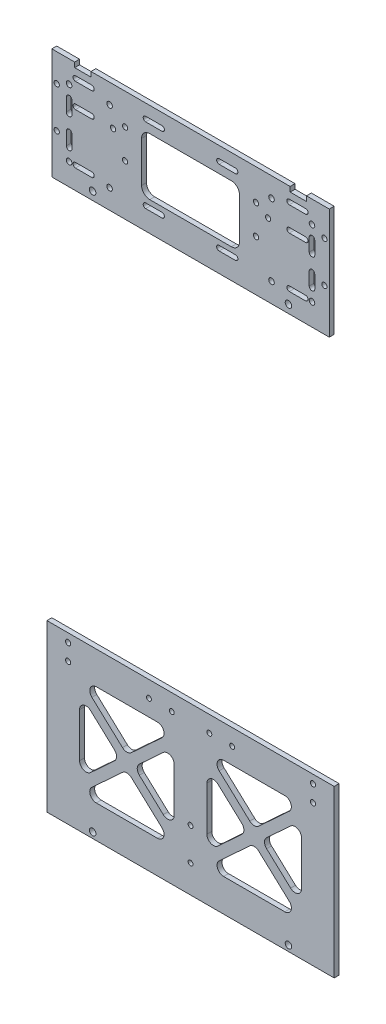
from build123d import *

# Parameters (mm, degrees)
SKETCH_1_W           = 176
SKETCH_1_H           = 403.5
SKETCH_1_R           = 2
EXTRUDE_1_DEPTH      = 3
SKETCH_3_R           = 1.6
SKETCH_3_R_2         = 1.5
SKETCH_3_W           = 60
SKETCH_3_H           = 35
CUT_EXTRUDE_2_DEPTH  = 247.278297866
SKETCH_5_R           = 1.5
CUT_EXTRUDE_3_DEPTH  = 247.278297866
SKETCH_7_W           = 58
SKETCH_7_H           = 61.65
CUT_EXTRUDE_4_DEPTH  = 247.278297866
SKETCH_11_R          = 1.6
SKETCH_11_W          = 176
SKETCH_11_H          = 236.85
CUT_EXTRUDE_7_DEPTH  = 10
SKETCH_12_W          = 10
SKETCH_12_H          = 3
CUT_EXTRUDE_8_DEPTH  = 247.278297866
SKETCH_13_R          = 1.5
CUT_EXTRUDE_9_DEPTH  = 247.278297866
FILLET_1_R           = 5
SKETCH_14_W          = 3
SKETCH_14_H          = 65
CUT_EXTRUDE_10_DEPTH = 247.278297866
SKETCH_15_R          = 1.5
SKETCH_15_W          = 3
SKETCH_15_H          = 10
CUT_EXTRUDE_11_DEPTH = 247.278297866
SKETCH_16_R          = 1.5
CUT_EXTRUDE_12_DEPTH = 247.278297866
EXTRUDE_2_DEPTH      = 3
FILLET_2_R           = 4
SKETCH_18_R          = 1.6
CUT_EXTRUDE_13_DEPTH = 247.278297866
SKETCH_19_W          = 14
SKETCH_19_H          = 3
SKETCH_19_W_2        = 122
EXTRUDE_3_DEPTH      = 3
SKETCH_20_R          = 1.7
CUT_EXTRUDE_14_DEPTH = 10
SKETCH_21_R          = 1.5
EXTRUDE_4_DEPTH      = 3
SKETCH_22_R          = 1.7
CUT_EXTRUDE_15_DEPTH = 3


with BuildPart() as part:
    # 草图1 → 凸台-拉伸1 (new body)
    with BuildSketch(Plane.XY):
        with Locations((0, 28.25)):
            Rectangle(SKETCH_1_W, SKETCH_1_H)
        with Locations((-60, 170)):
            Circle(SKETCH_1_R, mode=Mode.SUBTRACT)
        with Locations((60, 170)):
            Circle(SKETCH_1_R, mode=Mode.SUBTRACT)
        with Locations((-60, -170)):
            Circle(SKETCH_1_R, mode=Mode.SUBTRACT)
        with Locations((60, -170)):
            Circle(SKETCH_1_R, mode=Mode.SUBTRACT)
    extrude(amount=EXTRUDE_1_DEPTH)

    # 草图3 → 切除-拉伸2 (cut, through all)
    with BuildSketch(Plane(origin=(0, 0, 0), x_dir=(-1, 0, 0), z_dir=(0, 0, -1))):
        with Locations((-40.1, 214)):
            Circle(SKETCH_3_R)
        with Locations((-40.1, 196)):
            Circle(SKETCH_3_R)
        with Locations((40.1, 214)):
            Circle(SKETCH_3_R)
        with Locations((40.1, 196)):
            Circle(SKETCH_3_R)
        with Locations((0, -136.5)):
            Circle(SKETCH_3_R_2)
        with Locations((0, -156.5)):
            Circle(SKETCH_3_R_2)
        with Locations((0, 200.5)):
            Rectangle(SKETCH_3_W, SKETCH_3_H)
    extrude(amount=-CUT_EXTRUDE_2_DEPTH, mode=Mode.SUBTRACT)

    # 草图5 → 切除-拉伸3 (cut, through all)
    with BuildSketch(Plane(origin=(0, 0, 0), x_dir=(-1, 0, 0), z_dir=(0, 0, -1))):
        with Locations((11.5, -81.85)):
            Circle(SKETCH_5_R)
        with Locations((25.5, -81.85)):
            Circle(SKETCH_5_R)
        with Locations(Location((-25.5, -81.85, 0), (0, 0, 180))):
            Circle(SKETCH_5_R)
        with Locations(Location((-11.5, -81.85, 0), (0, 0, 180))):
            Circle(SKETCH_5_R)
    extrude(amount=-CUT_EXTRUDE_3_DEPTH, mode=Mode.SUBTRACT)

    # 草图7 → 切除-拉伸4 (cut, through all)
    with BuildSketch(Plane(origin=(0, 0, 0), x_dir=(-1, 0, 0), z_dir=(0, 0, -1))):
        with Locations((-39, -122.675)):
            Rectangle(SKETCH_7_W, SKETCH_7_H)
        with Locations((39, -122.675)):
            Rectangle(SKETCH_7_W, SKETCH_7_H)
    extrude(amount=-CUT_EXTRUDE_4_DEPTH, mode=Mode.SUBTRACT)

    # 草图11 → 切除-拉伸7 (cut)
    with BuildSketch(Plane(origin=(0, 0, 0), x_dir=(-1, 0, 0), z_dir=(0, 0, -1))):
        with Locations((-75, -77)):
            Circle(SKETCH_11_R)
        with Locations((-75, -87)):
            Circle(SKETCH_11_R)
        with Locations((75, -77)):
            Circle(SKETCH_11_R)
        with Locations((75, -87)):
            Circle(SKETCH_11_R)
        with Locations((-82, 216)):
            Circle(SKETCH_11_R)
        with Locations((-82, 191)):
            Circle(SKETCH_11_R)
        with Locations((82, 216)):
            Circle(SKETCH_11_R)
        with Locations((82, 191)):
            Circle(SKETCH_11_R)
        with Locations((0, 46.575)):
            Rectangle(SKETCH_11_W, SKETCH_11_H)
    extrude(amount=-CUT_EXTRUDE_7_DEPTH, mode=Mode.SUBTRACT)


with BuildPart() as cut_extrude_7_piece_1:
    # of the separate pieces the step leaves, piece 1, a body of its own (cut_extrude_7_pieces)
    add(part.part.solids().sort_by_distance((-88, -173.5, 0))[0])

    # 草图17 → 凸台-拉伸2 (add)
    with BuildSketch(Plane.XY.offset(3)):
        Polygon((-68, -91.85), (-39, -118.594042471), (-10, -91.85), (-10, -100.011915057), (-34.574798819, -122.675), (-10, -145.338084943), (-10, -153.5), (-39, -126.755957529), (-68, -153.5), (-68, -145.338084943), (-43.425201181, -122.675), (-68, -100.011915057), align=None)
        Polygon((10, -91.85), (39, -118.594042471), (68, -91.85), (68, -100.011915057), (43.425201181, -122.675), (68, -145.338084943), (68, -153.5), (39, -126.755957529), (10, -153.5), (10, -145.338084943), (34.574798819, -122.675), (10, -100.011915057), align=None)
    extrude(amount=-EXTRUDE_2_DEPTH)

    # 圆角2
    fillet_2_edges = [cut_extrude_7_piece_1.edges().sort_by_distance(p)[0] for p in [
        (10, -153.5, 1.5),
        (68, -153.5, 1.5),
        (68, -91.85, 1.5),
        (-68, -91.85, 1.5),
        (-68, -153.5, 1.5),
        (-10, -153.5, 1.5),
        (-10, -91.85, 1.5),
        (-43.425201181, -122.675, 1.5),
        (-68, -145.338084943, 1.5),
        (-39, -126.755957529, 1.5),
        (-10, -145.338084943, 1.5),
        (-34.574798819, -122.675, 1.5),
        (-10, -100.011915057, 1.5),
        (-39, -118.594042471, 1.5),
        (-68, -100.011915057, 1.5),
        (34.574798819, -122.675, 1.5),
        (10, -145.338084943, 1.5),
        (39, -126.755957529, 1.5),
        (68, -145.338084943, 1.5),
        (43.425201181, -122.675, 1.5),
        (68, -100.011915057, 1.5),
        (39, -118.594042471, 1.5),
        (10, -100.011915057, 1.5),
        (10, -91.85, 1.5),
    ]]
    fillet(fillet_2_edges, radius=FILLET_2_R)


with BuildPart() as cut_extrude_7_piece_2:
    # of the separate pieces the step leaves, piece 2, a body of its own (cut_extrude_7_pieces)
    add(part.part.solids().sort_by_distance((-88, 230, 0))[0])

    # 草图12 → 切除-拉伸8 (cut, through all)
    with BuildSketch(Plane(origin=(0, 0, 0), x_dir=(-1, 0, 0), z_dir=(0, 0, -1))):
        with Locations((-65.5, 224.5)):
            Rectangle(SKETCH_12_W, SKETCH_12_H)
        with Locations((-22.5, 224.5)):
            Rectangle(SKETCH_12_W, SKETCH_12_H)
        with Locations((65.5, 224.5)):
            Rectangle(SKETCH_12_W, SKETCH_12_H)
        with Locations((22.5, 224.5)):
            Rectangle(SKETCH_12_W, SKETCH_12_H)
        with Locations((-65.5, 209.5)):
            Rectangle(SKETCH_12_W, SKETCH_12_H)
        with Locations((-22.5, 209.5)):
            Rectangle(SKETCH_12_W, SKETCH_12_H)
        with Locations((22.5, 209.5)):
            Rectangle(SKETCH_12_W, SKETCH_12_H)
        with Locations((65.5, 209.5)):
            Rectangle(SKETCH_12_W, SKETCH_12_H)
        with Locations((-22.5, 178.5)):
            Rectangle(SKETCH_12_W, SKETCH_12_H)
        with Locations((22.5, 178.5)):
            Rectangle(SKETCH_12_W, SKETCH_12_H)
        with Locations((65.5, 178.5)):
            Rectangle(SKETCH_12_W, SKETCH_12_H)
        with Locations((-65.5, 178.5)):
            Rectangle(SKETCH_12_W, SKETCH_12_H)
    extrude(amount=-CUT_EXTRUDE_8_DEPTH, mode=Mode.SUBTRACT)

    # 草图13 → 切除-拉伸9 (cut, through all)
    with BuildSketch(Plane(origin=(0, 0, 0), x_dir=(-1, 0, 0), z_dir=(0, 0, -1))):
        with Locations((-60.5, 224.5)):
            Circle(SKETCH_13_R)
        with Locations((-70.5, 224.5)):
            Circle(SKETCH_13_R)
        with Locations((-27.5, 224.5)):
            Circle(SKETCH_13_R)
        with Locations((-17.5, 224.5)):
            Circle(SKETCH_13_R)
        with Locations((17.5, 224.5)):
            Circle(SKETCH_13_R)
        with Locations((27.5, 224.5)):
            Circle(SKETCH_13_R)
        with Locations((60.5, 224.5)):
            Circle(SKETCH_13_R)
        with Locations((70.5, 224.5)):
            Circle(SKETCH_13_R)
        with Locations((-60.5, 209.5)):
            Circle(SKETCH_13_R)
        with Locations((-70.5, 209.5)):
            Circle(SKETCH_13_R)
        with Locations((-27.5, 209.5)):
            Circle(SKETCH_13_R)
        with Locations((-17.5, 209.5)):
            Circle(SKETCH_13_R)
        with Locations((17.5, 209.5)):
            Circle(SKETCH_13_R)
        with Locations((27.5, 209.5)):
            Circle(SKETCH_13_R)
        with Locations((60.5, 209.5)):
            Circle(SKETCH_13_R)
        with Locations((70.5, 209.5)):
            Circle(SKETCH_13_R)
        with Locations((-60.5, 178.5)):
            Circle(SKETCH_13_R)
        with Locations((-70.5, 178.5)):
            Circle(SKETCH_13_R)
        with Locations((-27.5, 178.5)):
            Circle(SKETCH_13_R)
        with Locations((-17.5, 178.5)):
            Circle(SKETCH_13_R)
        with Locations((17.5, 178.5)):
            Circle(SKETCH_13_R)
        with Locations((27.5, 178.5)):
            Circle(SKETCH_13_R)
        with Locations((60.5, 178.5)):
            Circle(SKETCH_13_R)
        with Locations((70.5, 178.5)):
            Circle(SKETCH_13_R)
    extrude(amount=-CUT_EXTRUDE_9_DEPTH, mode=Mode.SUBTRACT)

    # 圆角1
    fillet_1_edges = [cut_extrude_7_piece_2.edges().sort_by_distance(p)[0] for p in [
        (-30, 183, 1.5),
        (30, 183, 1.5),
        (30, 218, 1.5),
        (-30, 218, 1.5),
    ]]
    fillet(fillet_1_edges, radius=FILLET_1_R)

    # 草图14 → 切除-拉伸10 (cut, through all)
    with BuildSketch(Plane(origin=(0, 0, 0), x_dir=(-1, 0, 0), z_dir=(0, 0, -1))):
        with Locations((-86.5, 197.5)):
            Rectangle(SKETCH_14_W, SKETCH_14_H)
        with Locations((86.5, 197.5)):
            Rectangle(SKETCH_14_W, SKETCH_14_H)
    extrude(amount=-CUT_EXTRUDE_10_DEPTH, mode=Mode.SUBTRACT)

    # 草图15 → 切除-拉伸11 (cut, through all)
    with BuildSketch(Plane(origin=(0, 0, 0), x_dir=(-1, 0, 0), z_dir=(0, 0, -1))):
        with Locations((-55, 200)):
            Circle(SKETCH_15_R)
        with Locations(Location((55, 200, 0), (0, 0, 180))):
            Circle(SKETCH_15_R)
        with Locations((-55, 217.5)):
            Rectangle(SKETCH_15_W, SKETCH_15_H)
        with Locations((-55, 182.5)):
            Rectangle(SKETCH_15_W, SKETCH_15_H)
        with Locations((55, 217.5)):
            Rectangle(SKETCH_15_W, SKETCH_15_H)
        with Locations((55, 182.5)):
            Rectangle(SKETCH_15_W, SKETCH_15_H)
    extrude(amount=-CUT_EXTRUDE_11_DEPTH, mode=Mode.SUBTRACT)

    # 草图16 → 切除-拉伸12 (cut, through all)
    with BuildSketch(Plane.XY.offset(3)):
        with Locations((-55, 222.5)):
            Circle(SKETCH_16_R)
        with Locations((-55, 212.5)):
            Circle(SKETCH_16_R)
        with Locations((-55, 187.5)):
            Circle(SKETCH_16_R)
        with Locations((-55, 177.5)):
            Circle(SKETCH_16_R)
        with Locations((55, 222.5)):
            Circle(SKETCH_16_R)
        with Locations((55, 212.5)):
            Circle(SKETCH_16_R)
        with Locations((55, 187.5)):
            Circle(SKETCH_16_R)
        with Locations((55, 177.5)):
            Circle(SKETCH_16_R)
    extrude(amount=-CUT_EXTRUDE_12_DEPTH, mode=Mode.SUBTRACT)

    # 草图18 → 切除-拉伸13 (cut, through all)
    with BuildSketch(Plane(origin=(0, 0, 0), x_dir=(-1, 0, 0), z_dir=(0, 0, -1))):
        with Locations((-47.5, 209.5)):
            Circle(SKETCH_18_R)
        with Locations((47.5, 209.5)):
            Circle(SKETCH_18_R)
    extrude(amount=-CUT_EXTRUDE_13_DEPTH, mode=Mode.SUBTRACT)

    # 草图19 → 凸台-拉伸3 (add)
    with BuildSketch(Plane(origin=(0, 0, 0), x_dir=(-1, 0, 0), z_dir=(0, 0, -1))):
        with Locations((-78, 231.5)):
            Rectangle(SKETCH_19_W, SKETCH_19_H)
        with Locations((78, 231.5)):
            Rectangle(SKETCH_19_W, SKETCH_19_H)
        with Locations((0, 231.5)):
            Rectangle(SKETCH_19_W_2, SKETCH_19_H)
    extrude(amount=-EXTRUDE_3_DEPTH)

    # 草图20 → 切除-拉伸14 (cut)
    with BuildSketch(Plane.XY.offset(3)):
        with Locations((74.4, 219.5)):
            Circle(SKETCH_20_R)
        with Locations((74.4, 178.5)):
            Circle(SKETCH_20_R)
        with Locations(Location((-74.4, 178.5, 0), (0, 0, 180))):
            Circle(SKETCH_20_R)
        with Locations(Location((-74.4, 219.5, 0), (0, 0, 180))):
            Circle(SKETCH_20_R)
        with BuildLine():
            Line((72.7, 186), (72.7, 194))
            ThreePointArc((72.7, 194), (74.4, 195.7), (76.1, 194))
            Line((76.1, 194), (76.1, 186))
            ThreePointArc((76.1, 186), (74.4, 184.3), (72.7, 186))
        make_face()
        with BuildLine():
            Line((72.7, 204), (72.7, 212))
            ThreePointArc((72.7, 212), (74.4, 213.7), (76.1, 212))
            Line((76.1, 212), (76.1, 204))
            ThreePointArc((76.1, 204), (74.4, 202.3), (72.7, 204))
        make_face()
        with BuildLine():
            Line((-72.7, 204), (-72.7, 212))
            ThreePointArc((-72.7, 212), (-74.4, 213.7), (-76.1, 212))
            Line((-76.1, 212), (-76.1, 204))
            ThreePointArc((-76.1, 204), (-74.4, 202.3), (-72.7, 204))
        make_face()
        with BuildLine():
            Line((-72.7, 186), (-72.7, 194))
            ThreePointArc((-72.7, 194), (-74.4, 195.7), (-76.1, 194))
            Line((-76.1, 194), (-76.1, 186))
            ThreePointArc((-76.1, 186), (-74.4, 184.3), (-72.7, 186))
        make_face()
    extrude(amount=-CUT_EXTRUDE_14_DEPTH, mode=Mode.SUBTRACT)

    # 草图21 → 凸台-拉伸4 (add)
    with BuildSketch(Plane.XY.offset(3)):
        with Locations((-55, 200)):
            Circle(SKETCH_21_R)
        with Locations((55, 200)):
            Circle(SKETCH_21_R)
        with BuildLine():
            Line((-53.5, 187.5), (-53.5, 177.5))
            ThreePointArc((-53.5, 177.5), (-55, 176), (-56.5, 177.5))
            Line((-56.5, 177.5), (-56.5, 187.5))
            ThreePointArc((-56.5, 187.5), (-55, 189), (-53.5, 187.5))
        make_face()
        with BuildLine():
            Line((-53.5, 222.5), (-53.5, 212.5))
            ThreePointArc((-53.5, 212.5), (-55, 211), (-56.5, 212.5))
            Line((-56.5, 212.5), (-56.5, 222.5))
            ThreePointArc((-56.5, 222.5), (-55, 224), (-53.5, 222.5))
        make_face()
        with BuildLine():
            Line((53.5, 177.5), (53.5, 187.5))
            ThreePointArc((53.5, 187.5), (55, 189), (56.5, 187.5))
            Line((56.5, 187.5), (56.5, 177.5))
            ThreePointArc((56.5, 177.5), (55, 176), (53.5, 177.5))
        make_face()
        with BuildLine():
            Line((56.5, 222.5), (56.5, 212.5))
            ThreePointArc((56.5, 212.5), (55, 211), (53.5, 212.5))
            Line((53.5, 212.5), (53.5, 222.5))
            ThreePointArc((53.5, 222.5), (55, 224), (56.5, 222.5))
        make_face()
    extrude(amount=-EXTRUDE_4_DEPTH)

    # 草图22 → 切除-拉伸15 (cut)
    with BuildSketch(Plane.XY.offset(3)):
        with Locations((49.6, 221)):
            Circle(SKETCH_22_R)
        with Locations((49.6, 177)):
            Circle(SKETCH_22_R)
        with Locations(Location((-49.6, 177, 0), (0, 0, 180))):
            Circle(SKETCH_22_R)
        with Locations(Location((-49.6, 221, 0), (0, 0, 180))):
            Circle(SKETCH_22_R)
    extrude(amount=-CUT_EXTRUDE_15_DEPTH, mode=Mode.SUBTRACT)


solid = Compound([cut_extrude_7_piece_1.part, cut_extrude_7_piece_2.part])
